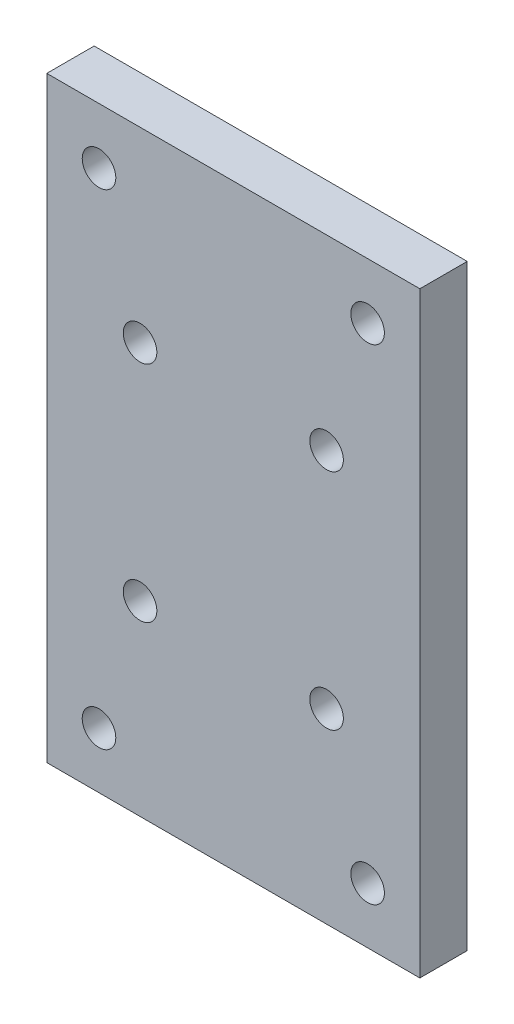
from build123d import *

# Parameters (mm, degrees)
SKETCH1_W           = 100
SKETCH1_H           = 160
BOSS_EXTRUDE1_DEPTH = 12.7
SKETCH2_R           = 4.5
CUT_EXTRUDE1_DEPTH  = 12.7
SKETCH3_R           = 4.5
CUT_EXTRUDE2_DEPTH  = 12.7


with BuildPart() as part:
    # Sketch1 → Boss-Extrude1 (new body)
    with BuildSketch(Plane.XY):
        with Locations((50, 80)):
            Rectangle(SKETCH1_W, SKETCH1_H)
    extrude(amount=BOSS_EXTRUDE1_DEPTH)

    # Sketch2 → Cut-Extrude1 (cut)
    with BuildSketch(Plane(origin=(0, 0, 12.7), x_dir=(-1, 0, 0), z_dir=(0, 0, 1))):
        with Locations(Location((-75, -110, 0), (0, 0, 180))):
            Circle(SKETCH2_R)
        with Locations(Location((-25, -110, 0), (0, 0, 180))):
            Circle(SKETCH2_R)
        with Locations((-25, -50)):
            Circle(SKETCH2_R)
        with Locations((-75, -50)):
            Circle(SKETCH2_R)
    extrude(amount=-CUT_EXTRUDE1_DEPTH, mode=Mode.SUBTRACT)

    # Sketch3 → Cut-Extrude2 (cut)
    with BuildSketch(Plane.XY.offset(12.7)):
        with Locations((14, 15)):
            Circle(SKETCH3_R)
        with Locations((86, 15)):
            Circle(SKETCH3_R)
        with Locations(Location((14, 145, 0), (0, 0, 180))):
            Circle(SKETCH3_R)
        with Locations(Location((86, 145, 0), (0, 0, 180))):
            Circle(SKETCH3_R)
    extrude(amount=-CUT_EXTRUDE2_DEPTH, mode=Mode.SUBTRACT)


solid = part.part
